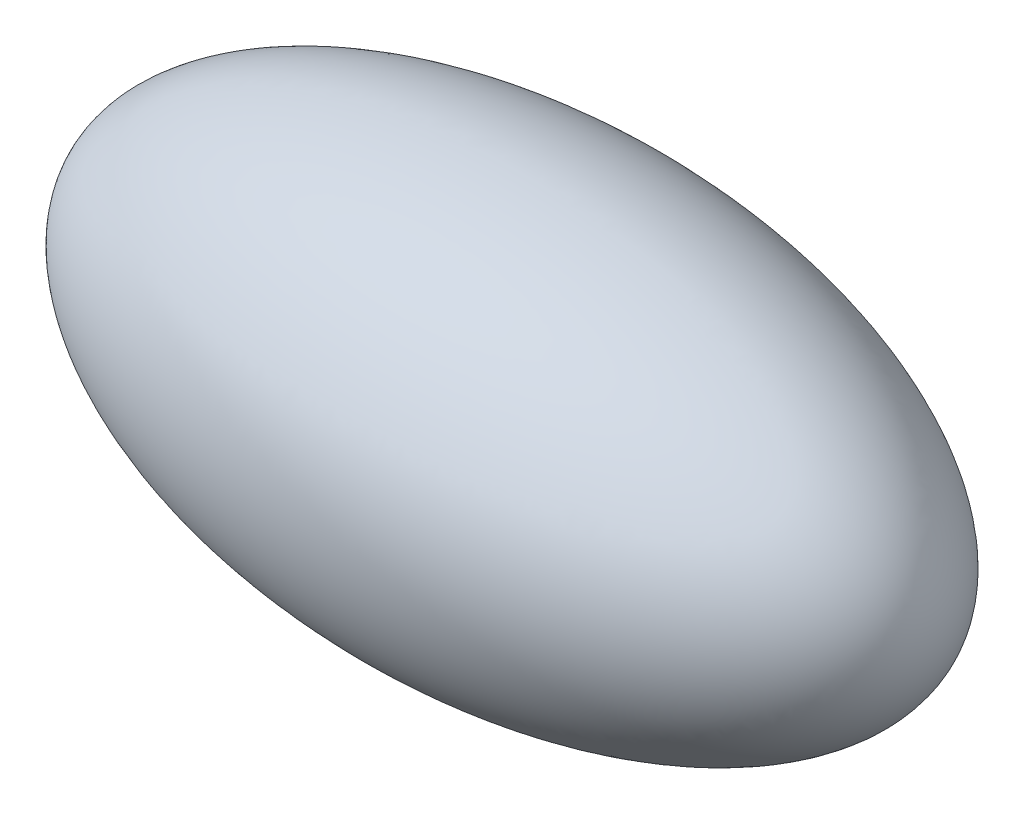
from build123d import *


with BuildPart() as part:
    # Sketch2 → Revolve1 (revolve)
    with BuildSketch(Plane.XY):
        with BuildLine():
            Line((-50, 25), (50, 25))
            add(Edge.make_bspline(
                [(-50, 25), (-50, 0), (0, 0), (50, 0), (50, 25)],
                knots=[3.141592654, 3.141592654, 3.141592654, 4.71238898, 4.71238898, 6.283185307, 6.283185307, 6.283185307], degree=2, weights=[1, 0.707106781, 1, 0.707106781, 1]))
        make_face()
    revolve(axis=Axis((-50, 25, 0), (1, 0, 0)))


solid = part.part
